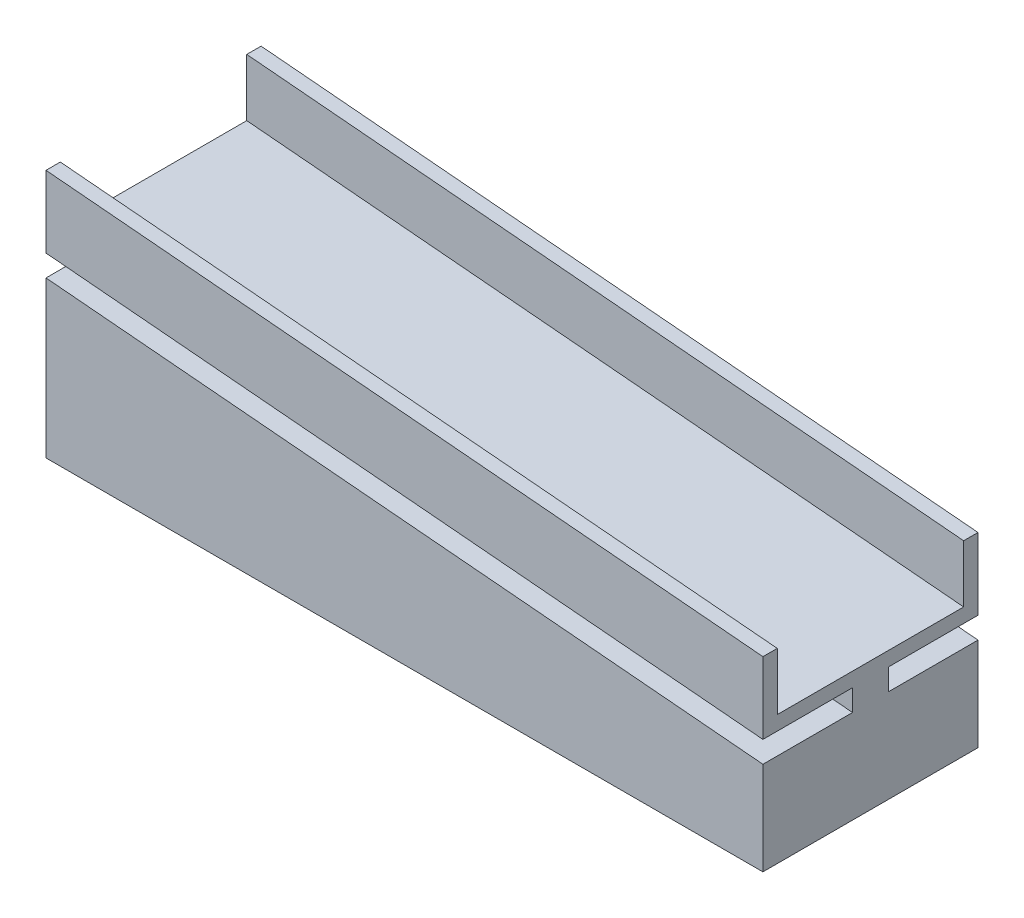
from build123d import *

# Parameters (mm, degrees)
SALIENTE_EXTRUIR1_DEPTH = 30
SALIENTE_EXTRUIR2_DEPTH = 2.5


with BuildPart() as part:
    # Croquis1 → Saliente-Extruir1 (new body)
    with BuildSketch(Plane.XY):
        Polygon((0, 0), (0, 21.748866353), (100, 13), (100, 0), align=None)
    extrude(amount=SALIENTE_EXTRUIR1_DEPTH)

    # Croquis3 → Saliente-Extruir2 (add, symmetric)
    with BuildSketch(Plane.XY.offset(15)):
        Polygon((0, 21.748866353), (100, 13), (100, 16), (0, 24.748866353), align=None)
    extrude(amount=SALIENTE_EXTRUIR2_DEPTH, both=True)

    # Barrer1: sweep along a path in Croquis4
    with BuildLine(Plane.XY.offset(15)) as barrer1_path:
        Line((0, 24.748866353), (100, 16))
    # Croquis5 → Barrer1 (sweep)
    with BuildSketch(Plane.ZY):
        Polygon((28, 34.748866353), (30, 34.748866353), (30, 24.748866353), (0, 24.748866353), (0, 34.748866353), (2, 34.748866353), (2, 26.748866353), (28, 26.748866353), align=None)
    sweep(path=barrer1_path.line)


solid = part.part
